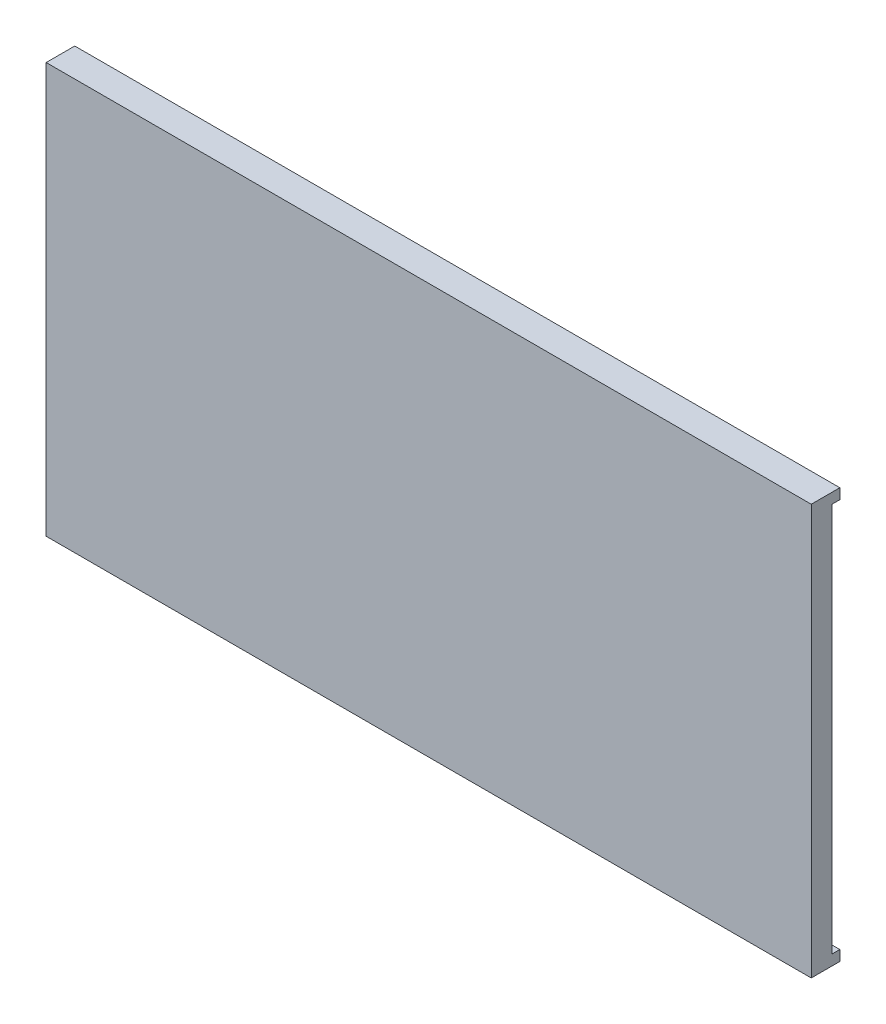
from build123d import *

# Parameters (mm, degrees)
EXTRUDE_2_DEPTH      = 8
EXTRUDE_2_DEPTH_BACK = 3
SKETCH_3_W           = 294.4
SKETCH_3_H           = 157.879
SKETCH_2_W           = 290.4
SKETCH_2_H           = 149.879
CUT_EXTRUDE_2_DEPTH  = 3
SKETCH_5_R           = 8.15
CUT_EXTRUDE_3_DEPTH  = 7


with BuildPart() as part:
    # 草图3 → 凸台-拉伸2 (new, two sides: drawn at the far end of the back side and taken through both)
    with BuildSketch(Plane.XY.offset(-EXTRUDE_2_DEPTH_BACK)):
        with Locations((103.122, -9.5885)):
            Rectangle(SKETCH_3_W, SKETCH_3_H)
    extrude(amount=EXTRUDE_2_DEPTH + EXTRUDE_2_DEPTH_BACK)

    # 草图2 → 切除-拉伸2 (cut)
    with BuildSketch(Plane.XY):
        with Locations((105.122, -9.5885)):
            Rectangle(SKETCH_2_W, SKETCH_2_H)
    extrude(amount=-CUT_EXTRUDE_2_DEPTH, mode=Mode.SUBTRACT)

    # 草图5 → 切除-拉伸3 (cut)
    with BuildSketch(Plane.XY):
        with Locations((-28.645, 19.55)):
            Circle(SKETCH_5_R)
        with Locations((-9.52, 19.55)):
            Circle(SKETCH_5_R)
        with Locations((9.53, 19.55)):
            Circle(SKETCH_5_R)
        with Locations((28.58, 19.55)):
            Circle(SKETCH_5_R)
        with Locations((47.63, 19.55)):
            Circle(SKETCH_5_R)
        with Locations((66.68, 19.55)):
            Circle(SKETCH_5_R)
        with Locations((85.73, 19.55)):
            Circle(SKETCH_5_R)
        with Locations((104.78, 19.55)):
            Circle(SKETCH_5_R)
        with Locations((123.83, 19.55)):
            Circle(SKETCH_5_R)
        with Locations((142.88, 19.55)):
            Circle(SKETCH_5_R)
        with Locations((161.93, 19.55)):
            Circle(SKETCH_5_R)
        with Locations((180.98, 19.55)):
            Circle(SKETCH_5_R)
        with Locations((228.66, 19.55)):
            Circle(SKETCH_5_R)
        with Locations((171.45, 0)):
            Circle(SKETCH_5_R)
        with Locations((152.4, 0)):
            Circle(SKETCH_5_R)
        with Locations((133.35, 0)):
            Circle(SKETCH_5_R)
        with Locations((114.3, 0)):
            Circle(SKETCH_5_R)
        with Locations((95.25, 0)):
            Circle(SKETCH_5_R)
        with Locations((76.2, 0)):
            Circle(SKETCH_5_R)
        with Locations((57.15, 0)):
            Circle(SKETCH_5_R)
        with Locations((38.1, 0)):
            Circle(SKETCH_5_R)
        with Locations((19.05, 0)):
            Circle(SKETCH_5_R)
        Circle(SKETCH_5_R)
        with Locations((-21.495, -19.05)):
            Circle(SKETCH_5_R)
        with Locations((4.76, -19.05)):
            Circle(SKETCH_5_R)
        with Locations((23.81, -19.05)):
            Circle(SKETCH_5_R)
        with Locations((42.86, -19.05)):
            Circle(SKETCH_5_R)
        with Locations((61.91, -19.05)):
            Circle(SKETCH_5_R)
        with Locations((80.96, -19.05)):
            Circle(SKETCH_5_R)
        with Locations((100.01, -19.05)):
            Circle(SKETCH_5_R)
        with Locations((119.06, -19.05)):
            Circle(SKETCH_5_R)
        with Locations((138.11, -19.05)):
            Circle(SKETCH_5_R)
        with Locations((157.16, -19.05)):
            Circle(SKETCH_5_R)
        with Locations((176.21, -19.05)):
            Circle(SKETCH_5_R)
        with Locations((195.26, -19.05)):
            Circle(SKETCH_5_R)
        with Locations((226.28, -19.05)):
            Circle(SKETCH_5_R)
        with Locations((185.74, -38.1)):
            Circle(SKETCH_5_R)
        with Locations((166.69, -38.1)):
            Circle(SKETCH_5_R)
        with Locations((147.64, -38.1)):
            Circle(SKETCH_5_R)
        with Locations((128.59, -38.1)):
            Circle(SKETCH_5_R)
        with Locations((109.54, -38.1)):
            Circle(SKETCH_5_R)
        with Locations((90.49, -38.1)):
            Circle(SKETCH_5_R)
        with Locations((71.44, -38.1)):
            Circle(SKETCH_5_R)
        with Locations((52.39, -38.1)):
            Circle(SKETCH_5_R)
        with Locations((33.34, -38.1)):
            Circle(SKETCH_5_R)
        with Locations((14.29, -38.1)):
            Circle(SKETCH_5_R)
        with Locations((-16.73, -38.1)):
            Circle(SKETCH_5_R)
        with Locations((-27.455, -57.53)):
            Circle(SKETCH_5_R)
        with Locations((-2.38, -57.53)):
            Circle(SKETCH_5_R)
        with Locations((21.43, -57.53)):
            Circle(SKETCH_5_R)
        with Locations((92.87, -57.53)):
            Circle(SKETCH_5_R)
    extrude(amount=CUT_EXTRUDE_3_DEPTH, mode=Mode.SUBTRACT)


solid = part.part
